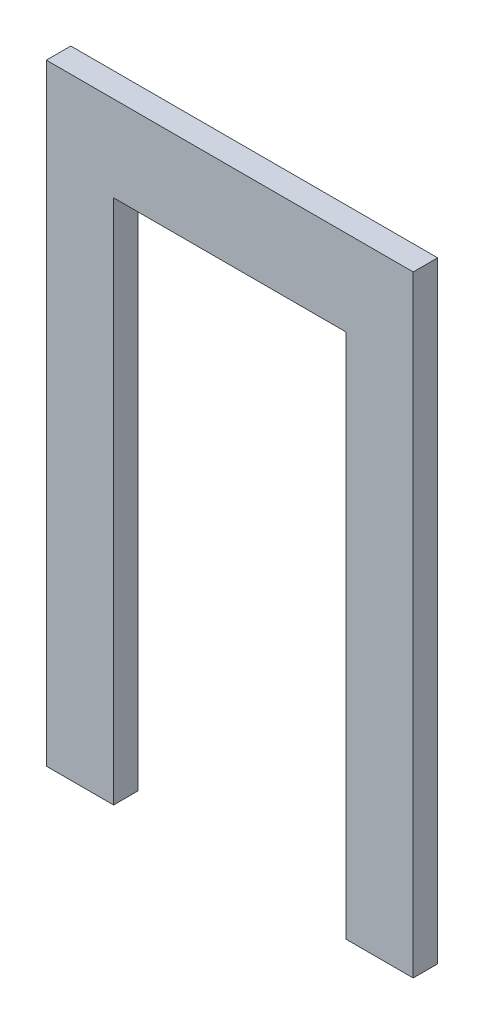
from build123d import *

# Parameters (mm, degrees)
SALIENTE_EXTRUIR1_DEPTH = 100


with BuildPart() as part:
    # Croquis1 → Saliente-Extruir1 (new body)
    with BuildSketch(Plane.XY):
        Polygon((-475, -1250), (-475, 900), (475, 900), (475, -1250), (750, -1250), (750, 1250), (-750, 1250), (-750, -1250), align=None)
    extrude(amount=SALIENTE_EXTRUIR1_DEPTH)


solid = part.part
